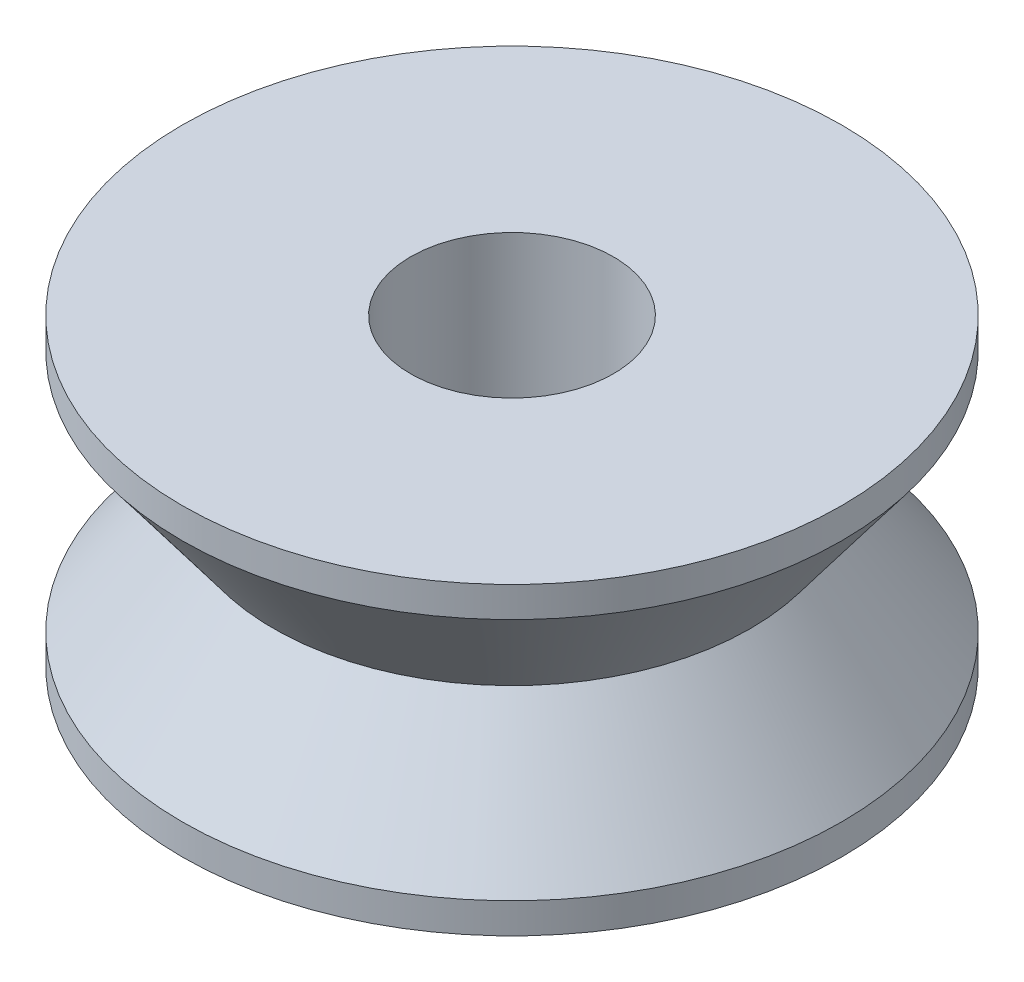
from build123d import *

# Parameters (mm, degrees)
SKETCH_2_R          = 2
CUT_EXTRUDE_1_DEPTH = 10


with BuildPart() as part:
    # ｽｹｯﾁ1 → 回転1 (revolve)
    with BuildSketch(Plane.XY):
        Polygon((4.7, 0), (6.5, -2.4), (6.5, -3), (0, -3), (0, 3), (6.5, 3), (6.5, 2.4), align=None)
    revolve(axis=Axis((0, -3, 0), (0, 1, 0)))

    # ｽｹｯﾁ2 → ｶｯﾄ - 押し出し1 (cut)
    with BuildSketch(Plane(origin=(0, 3, 0), x_dir=(1, 0, 0), z_dir=(0, 1, 0))):
        with Locations(Location((0, 0, 0), (0, 0, 180))):
            Circle(SKETCH_2_R)
    extrude(amount=-CUT_EXTRUDE_1_DEPTH, mode=Mode.SUBTRACT)


solid = part.part
